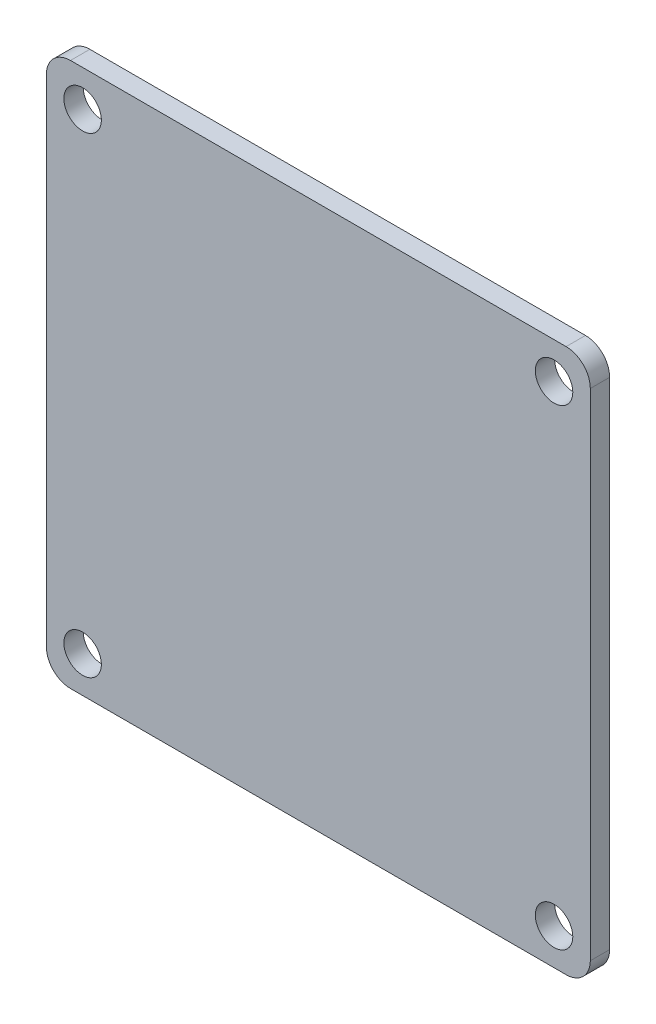
from build123d import *

# Parameters (mm, degrees)
SKIZZE1_W                       = 45
SKIZZE1_H                       = 45
SKIZZE1_R                       = 1.55
AUFSATZ_LINEAR_AUSTRAGEN1_DEPTH = 1.6
VERRUNDUNG1_R                   = 2


with BuildPart() as part:
    # Skizze1 → Aufsatz-Linear austragen1 (new body)
    with BuildSketch(Plane.XY):
        with Locations((22.5, 22.5)):
            Rectangle(SKIZZE1_W, SKIZZE1_H)
        with Locations((3, 42)):
            Circle(SKIZZE1_R, mode=Mode.SUBTRACT)
        with Locations((42, 42)):
            Circle(SKIZZE1_R, mode=Mode.SUBTRACT)
        with Locations((42, 3)):
            Circle(SKIZZE1_R, mode=Mode.SUBTRACT)
        with Locations((3, 3)):
            Circle(SKIZZE1_R, mode=Mode.SUBTRACT)
    extrude(amount=AUFSATZ_LINEAR_AUSTRAGEN1_DEPTH)

    # Verrundung1
    verrundung1_edges = [part.edges().sort_by_distance(p)[0] for p in [
        (0, 45, 0.8),
        (45, 45, 0.8),
        (45, 0, 0.8),
        (0, 0, 0.8),
    ]]
    fillet(verrundung1_edges, radius=VERRUNDUNG1_R)


solid = part.part
